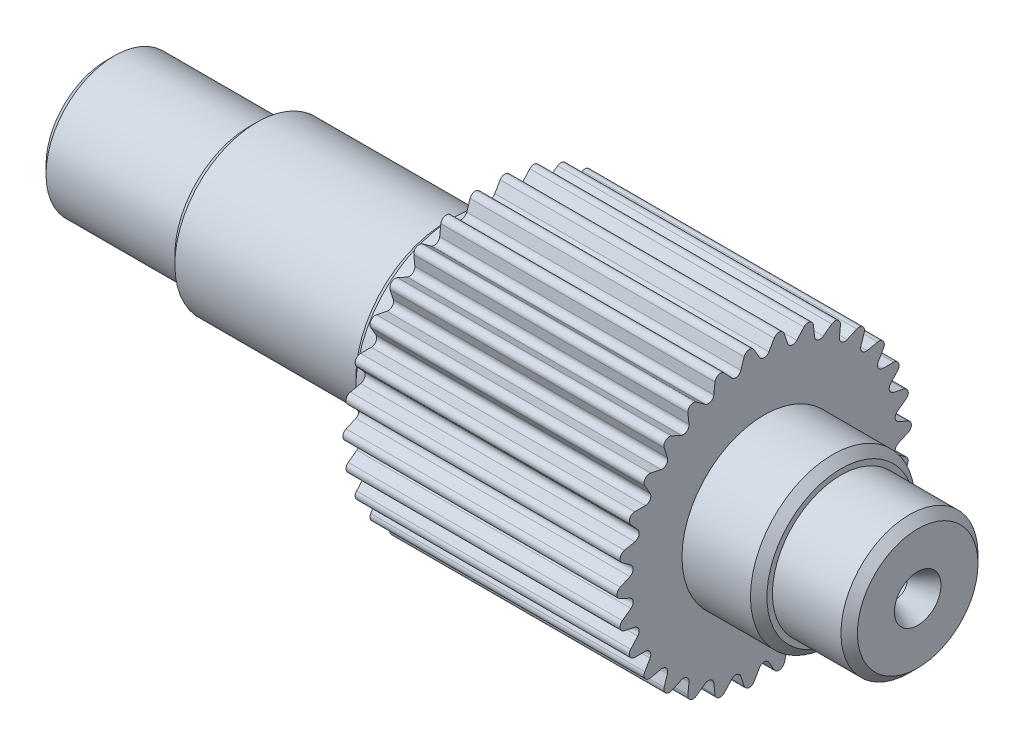
from build123d import *

# Parameters (mm, degrees)
CUT_EXTRUDE_START        = 10
CUT_EXTRUDE_1_DEPTH      = 164.502052104
CUT_EXTRUDE_2_DEPTH      = 127.723636311
PATTERN_CIRCULAR_1_COUNT = 30
FILLET_2_R               = 1
CHAMFER_1_SIZE           = 1.5


with BuildPart() as part:
    # Эскиз1 → Повернуть1 (revolve)
    with BuildSketch(Plane.XY, mode=Mode.PRIVATE) as revolve_1_sk:
        Polygon((0, -12.5), (26, -12.5), (26, -15), (62, -15), (62, -18), (70, -18), (70, -28.8), (120, -28.8), (120, -15), (134, -15), (134, -12.5), (148, -12.5), (148, 0), (0, 0), align=None)
    revolve(revolve_1_sk.sketch.rotate(Axis((0, 0, 0), (1, 0, 0)), 270), axis=Axis((0, 0, 0), (1, 0, 0)))

    # Эскиз2 → Вырез-Повернуть1 (revolve, cut)
    with BuildSketch(Plane.XY, mode=Mode.PRIVATE) as cut_revolve_1_sk:
        Polygon((0, 4.25), (3.9, 2), (8.9, 2), (10.054700538, 0), (0, 0), align=None)
    cut_revolve_1 = revolve(cut_revolve_1_sk.sketch.rotate(Axis((0, 0, 0), (1, 0, 0)), 90), axis=Axis((0, 0, 0), (1, 0, 0)), mode=Mode.SUBTRACT)

    # Зеркальное отражение1: Вырез-Повернуть1 across plane
    add(cut_revolve_1.mirror(Plane.ZY.offset(-74)), mode=Mode.SUBTRACT)

    # Эскиз3 → Вырез-Вытянуть1 (cut, through all)
    with BuildSketch(Plane.XY.offset(CUT_EXTRUDE_START)):
        with BuildLine():
            Line((37, 4), (51, 4))
            ThreePointArc((51, 4), (55, 0), (51, -4))
            Line((51, -4), (37, -4))
            ThreePointArc((37, -4), (33, 0), (37, 4))
        make_face()
    extrude(amount=-CUT_EXTRUDE_1_DEPTH, mode=Mode.SUBTRACT)

    # Эскиз4 → Вырез-Вытянуть2 (cut, through all)
    with BuildSketch(Plane(origin=(120, 0, 0), x_dir=(0, 0, -1), z_dir=(1, 0, 0))):
        Polygon((5, 31.686751346), (-5, 31.686751346), (0, 23.026497308), align=None)
    cut_extrude_2 = extrude(amount=-CUT_EXTRUDE_2_DEPTH, mode=Mode.SUBTRACT)

    # Круговой массив1: Вырез-Вытянуть2 ×30 about axis
    pattern_circular_1_axis = Axis((0, 0, 0), (1, 0, 0))
    for i in range(1, PATTERN_CIRCULAR_1_COUNT):
        add(cut_extrude_2.rotate(pattern_circular_1_axis, i * 360 / PATTERN_CIRCULAR_1_COUNT), mode=Mode.SUBTRACT)

    # Скругление2
    fillet_2_edges = [part.edges().sort_by_distance(p)[0] for p in [
        (95, 22.523313095, -4.787477989),
        (95, 21.035752021, -9.365720217),
        (95, 26.92098276, -8.747157541),
        (95, 18.628827643, -13.53463553),
        (95, 24.514058382, -14.153198206),
        (95, 11.513248654, -19.941531629),
        (95, 16.638082356, -22.900355747),
        (95, 15.407734106, -17.112022323),
        (95, 21.035752021, -18.940676195),
        (95, 7.115578989, -21.899500312),
        (95, 11.513248654, -25.859179864),
        (95, 2.406924378, -22.900355747),
        (95, 5.885230739, -27.687833735),
        (95, -7.115578989, -21.899500312),
        (95, -5.885230739, -27.687833735),
        (95, -2.406924378, -22.900355747),
        (95, 0, -28.306396412),
        (95, -11.513248654, -19.941531629),
        (95, -11.513248654, -25.859179864),
        (95, -15.407734106, -17.112022323),
        (95, -16.638082356, -22.900355747),
        (95, -21.035752021, -9.365720217),
        (95, -24.514058382, -14.153198206),
        (95, -18.628827643, -13.53463553),
        (95, -21.035752021, -18.940676195),
        (95, -22.523313095, -4.787477989),
        (95, -26.92098276, -8.747157541),
        (95, -23.026497308, 0),
        (95, -28.15133101, -2.958824118),
        (95, -21.035752021, 9.365720217),
        (95, -26.92098276, 8.747157541),
        (95, -22.523313095, 4.787477989),
        (95, -28.15133101, 2.958824118),
        (95, -18.628827643, 13.53463553),
        (95, -24.514058382, 14.153198206),
        (95, -15.407734106, 17.112022323),
        (95, -21.035752021, 18.940676195),
        (95, -7.115578989, 21.899500312),
        (95, -11.513248654, 25.859179864),
        (95, -11.513248654, 19.941531629),
        (95, -16.638082356, 22.900355747),
        (95, -2.406924378, 22.900355747),
        (95, -5.885230739, 27.687833735),
        (95, 2.406924378, 22.900355747),
        (95, 0, 28.306396412),
        (95, 11.513248654, 19.941531629),
        (95, 11.513248654, 25.859179864),
        (95, 7.115578989, 21.899500312),
        (95, 5.885230739, 27.687833735),
        (95, 15.407734106, 17.112022323),
        (95, 16.638082356, 22.900355747),
        (95, 18.628827643, 13.53463553),
        (95, 21.035752021, 18.940676195),
        (95, 22.523313095, 4.787477989),
        (95, 26.92098276, 8.747157541),
        (95, 21.035752021, 9.365720217),
        (95, 24.514058382, 14.153198206),
        (95, 23.026497308, 0),
        (95, 28.15133101, 2.958824118),
        (95, 28.15133101, -2.958824118),
    ]]
    fillet(fillet_2_edges, radius=FILLET_2_R)

    # Фаска1
    chamfer_1_edges = [part.edges().sort_by_distance(p)[0] for p in [
        (148, 0, -12.5),
        (134, 0, -15),
        (62, 0, -18),
        (26, 0, -15),
        (0, 0, -12.5),
    ]]
    chamfer(chamfer_1_edges, length=CHAMFER_1_SIZE)


solid = part.part
